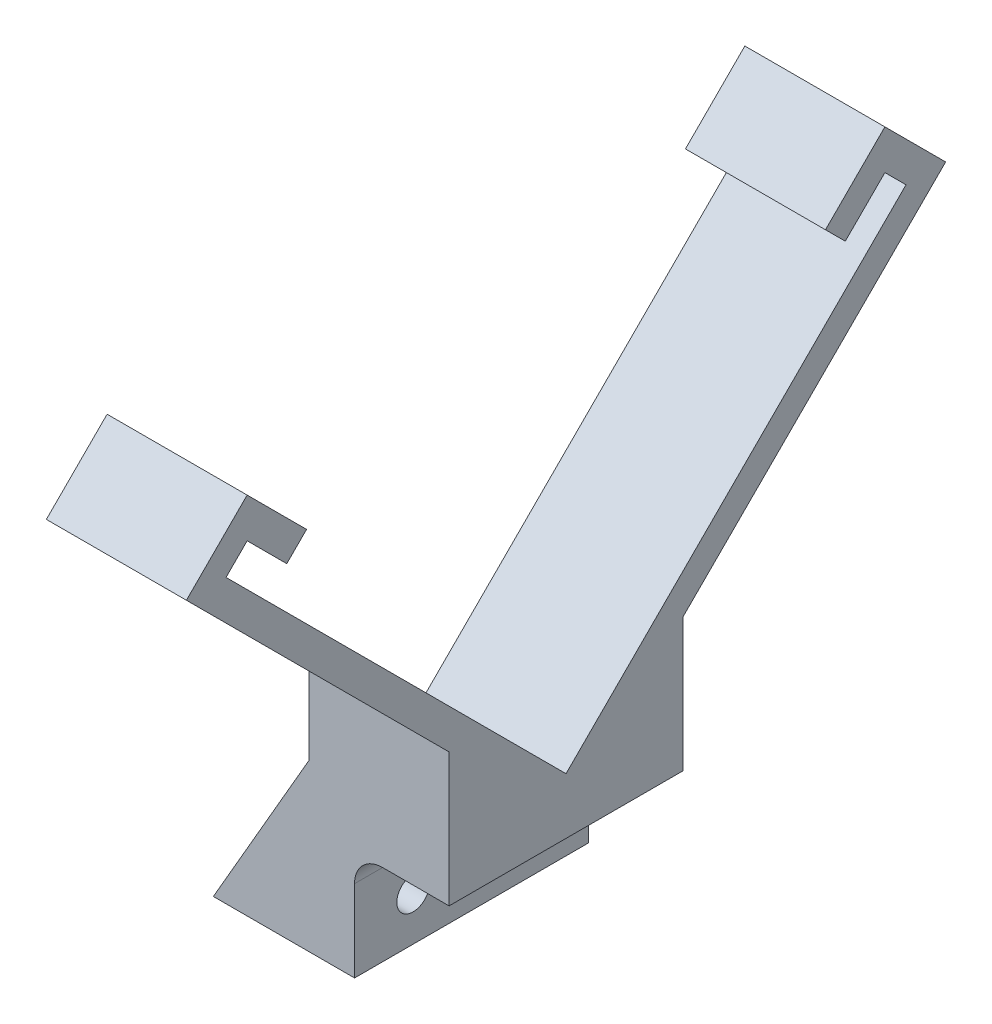
from build123d import *

# Parameters (mm, degrees)
BOSS_EXTRUDE1_DEPTH = 25.05
SKETCH3_R           = 1.75
CUT_EXTRUDE2_DEPTH  = 35.224258664
FILLET1_R           = 3
BOSS_EXTRUDE2_DEPTH = 15


with BuildPart() as part:
    # Sketch1 → Boss-Extrude1 (new body)
    with BuildSketch(Plane.XY):
        Polygon((0, 0), (-10.247967278, -17.75), (4.876016361, -17.75), (4.876016361, -6), (15, -6), (15, 0), align=None)
    extrude(amount=BOSS_EXTRUDE1_DEPTH)

    # Sketch3 → Cut-Extrude2 (cut, through all)
    with BuildSketch(Plane(origin=(4.876016361, 0, 0), x_dir=(0, 0, -1), z_dir=(1, 0, 0))):
        with Locations(Location((-18.775, -13, 0), (0, 0, 90))):
            Circle(SKETCH3_R)
        with Locations(Location((-6.275, -13, 0), (0, 0, 90))):
            Circle(SKETCH3_R)
    extrude(amount=-CUT_EXTRUDE2_DEPTH, mode=Mode.SUBTRACT)

    # Fillet1
    fillet1_edges = [part.edges().sort_by_distance(p)[0] for p in [
        (4.876016361, -6, 12.525),
    ]]
    fillet(fillet1_edges, radius=FILLET1_R)

    # Sketch4 → Boss-Extrude2 (add)
    with BuildSketch(Plane(origin=(15, 0, 0), x_dir=(0, 0, -1), z_dir=(1, 0, 0))):
        Polygon((-25.05, 8.282359313), (-53.183639918, 36.415999231), (-46.678257531, 42.921381618), (-40.314296501, 36.557420587), (-42.435616844, 34.436100244), (-46.678257531, 38.678740931), (-48.940999231, 36.415999231), (-12.525, 0), (23.890999231, 36.415999231), (21.628257531, 38.678740931), (17.385616844, 34.436100244), (15.264296501, 36.557420587), (21.628257531, 42.921381618), (28.133639918, 36.415999231), (0, 8.282359313), (0, -6), (-25.05, -6), align=None)
    extrude(amount=-BOSS_EXTRUDE2_DEPTH)


solid = part.part
